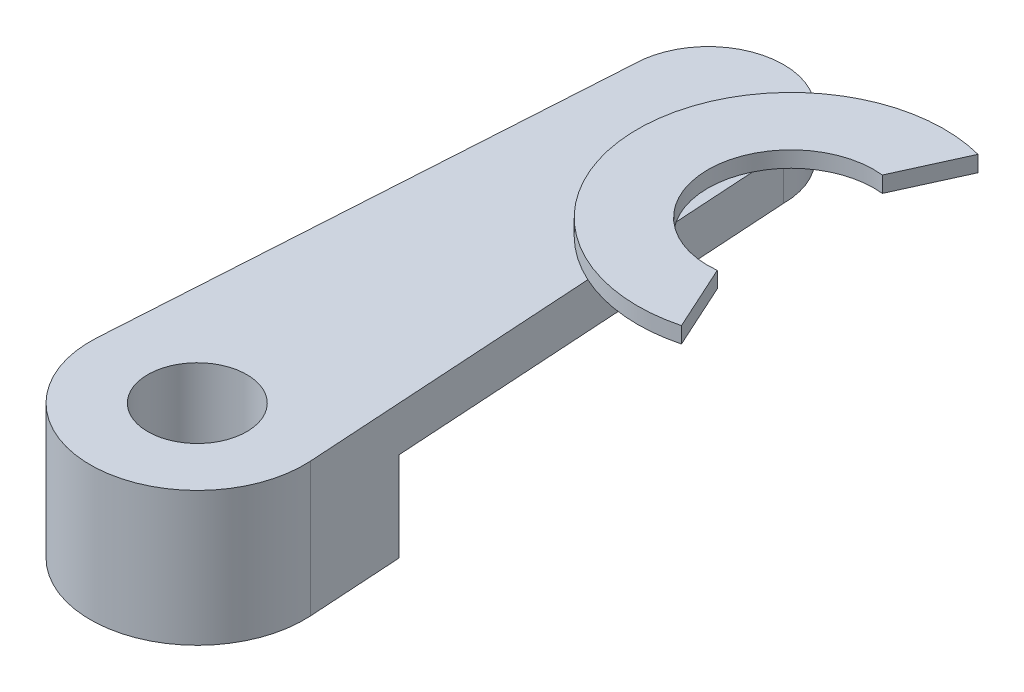
from build123d import *

# Parameters (mm, degrees)
BOSS_EXTRUDE1_DEPTH = 4.2
SKETCH2_R           = 1.550030902
CUT_EXTRUDE1_DEPTH  = 4.2
WASHER_DEPTH        = 0.5
SKETCH4_W           = 15.014396114
SKETCH4_H           = 18.830226703
CUT_EXTRUDE2_DEPTH  = 2.8


with BuildPart() as part:
    # Sketch1 → Boss-Extrude1 (new body)
    with BuildSketch(Plane(origin=(0, 0, 0), x_dir=(1, 0, 0), z_dir=(0, 1, 0))):
        with BuildLine():
            Line((-2.361421162, 16), (-3.343540366, 0.207937064))
            ThreePointArc((-3.343540366, 0.207937064), (0, -3.35), (3.343540366, 0.207937064))
            Line((3.343540366, 0.207937064), (2.361421162, 16))
            ThreePointArc((2.361421162, 16), (0, 18.361421162), (-2.361421162, 16))
        make_face()
    extrude(amount=BOSS_EXTRUDE1_DEPTH)

    # Sketch2 → Cut-Extrude1 (cut)
    with BuildSketch(Plane(origin=(0, 4.2, 0), x_dir=(1, 0, 0), z_dir=(0, 1, 0))):
        with Locations(Location((0, 0, 0), (0, 0, 270))):
            Circle(SKETCH2_R)
    extrude(amount=-CUT_EXTRUDE1_DEPTH, mode=Mode.SUBTRACT)

    # Sketch3 → Washer (add)
    with BuildSketch(Plane(origin=(0, 4.2, 0), x_dir=(1, 0, 0), z_dir=(0, 1, 0))):
        with BuildLine():
            Line((5.978845304, 9.183192045), (5.040969257, 11.241624252))
            ThreePointArc((5.040969257, 11.241624252), (2.163457141, 13.826055508), (5.039545151, 16.412071489))
            Line((5.039545151, 16.412071489), (5.976287141, 18.471020026))
            ThreePointArc((5.976287141, 18.471020026), (-0.036542776, 13.825449558), (5.978845304, 9.183192045))
        make_face()
    extrude(amount=WASHER_DEPTH)

    # Sketch4 → Cut-Extrude2 (cut)
    with BuildSketch(Plane(origin=(0, 0, 0), x_dir=(-1, 0, 0), z_dir=(0, -1, 0))):
        with Locations((-0.264298209, 12.569563008)):
            Rectangle(SKETCH4_W, SKETCH4_H)
    extrude(amount=-CUT_EXTRUDE2_DEPTH, mode=Mode.SUBTRACT)


solid = part.part
